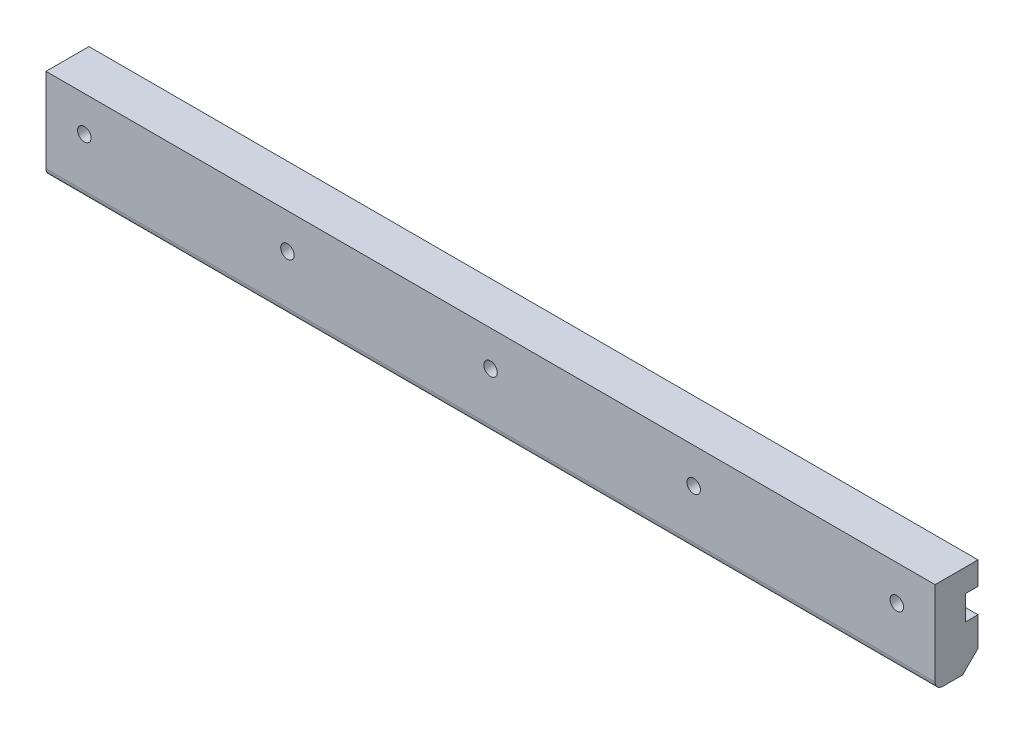
from build123d import *

# Parameters (mm, degrees)
SKETCH_1_W       = 20
SKETCH_1_H       = 16
SKETCH_1_W_2     = 28
SKETCH_1_H_2     = 29
EXTRUDE_1_DEPTH  = 580
CHAMFER_1_SIZE   = 10
M10X1_25_1_D     = 8.8
M10X1_25_1_DEPTH = 59
M10X1_25_1_TIP   = 2.643786724
FILLET_1_R       = 5


with BuildPart() as part:
    # 草圖1 → 填料-伸長1 (new body)
    with BuildSketch(Plane(origin=(0, 0, 0), x_dir=(0, 0, -1), z_dir=(1, 0, 0))):
        Polygon((0, 60), (0, 45), (20, 45), (28, 45), (28, 60), align=None)
        with Locations((10, 37)):
            Rectangle(SKETCH_1_W, SKETCH_1_H)
        with Locations((14, 14.5)):
            Rectangle(SKETCH_1_W_2, SKETCH_1_H_2)
    extrude(amount=EXTRUDE_1_DEPTH)

    # 導角1
    chamfer_1_edges = [part.edges().sort_by_distance(p)[0] for p in [
        (290, 0, -28),
    ]]
    chamfer(chamfer_1_edges, length=CHAMFER_1_SIZE)

    # M10x1.25 螺紋孔1
    with Locations(Plane(origin=(0, 0, -20), x_dir=(-1, 0, 0), z_dir=(0, 0, -1))):
        with Locations((-555, 37), (-422.5, 37), (-290, 37), (-157.5, 37), (-25, 37)):
            Hole(M10X1_25_1_D / 2, depth=M10X1_25_1_DEPTH)
            with Locations((0, 0, -(M10X1_25_1_DEPTH + M10X1_25_1_TIP / 2))):  # 118° drill point
                Cone(0, M10X1_25_1_D / 2, M10X1_25_1_TIP, mode=Mode.SUBTRACT)

    # 圓角1
    fillet_1_edges = [part.edges().sort_by_distance(p)[0] for p in [
        (290, 0, 0),
    ]]
    fillet(fillet_1_edges, radius=FILLET_1_R)


solid = part.part
